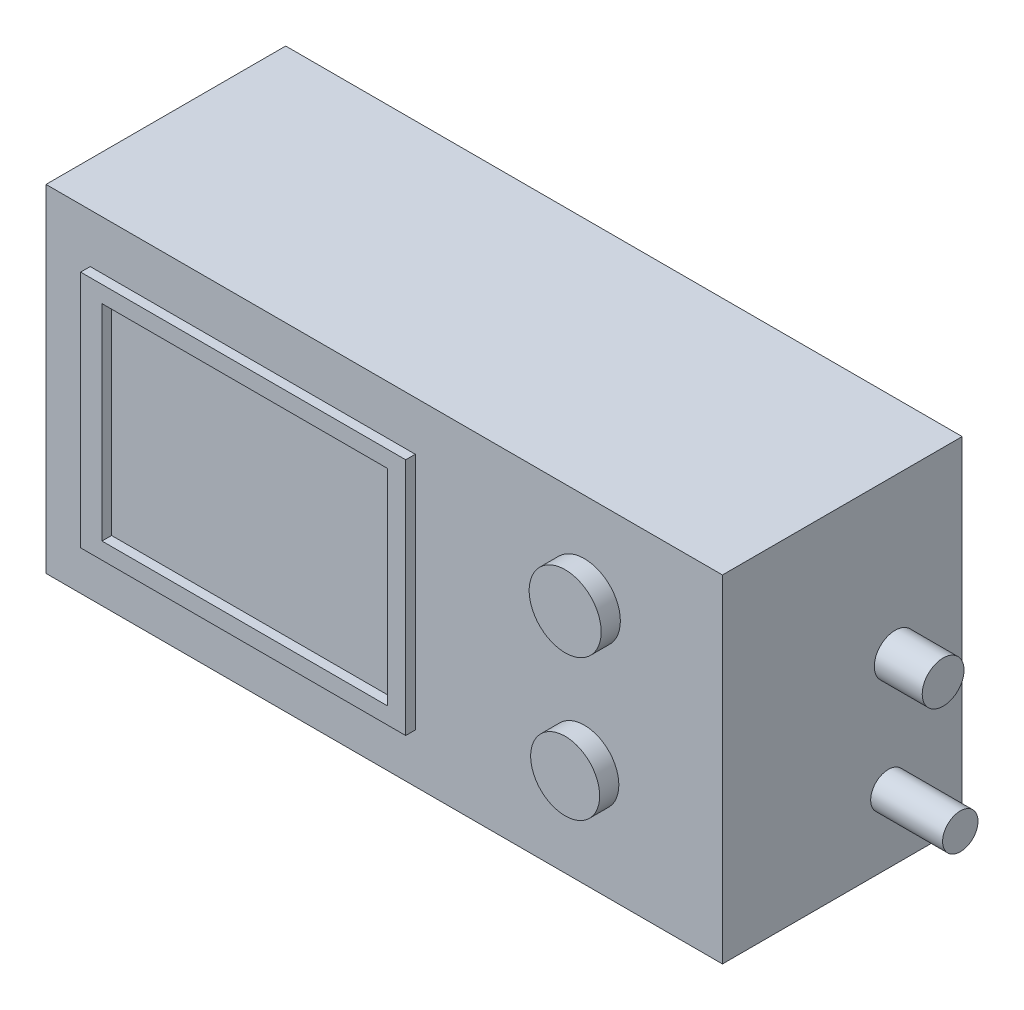
from build123d import *

# Parameters (mm, degrees)
SKETCH1_W           = 141.104496432
SKETCH1_H           = 70.279121138
BOSS_EXTRUDE1_DEPTH = 50
SKETCH2_W           = 67.805568122
SKETCH2_H           = 49.81527963
SKETCH2_W_2         = 59.592894194
SKETCH2_H_2         = 42.894286786
BOSS_EXTRUDE2_DEPTH = 2
SKETCH3_R           = 7.50966637
SKETCH3_R_2         = 7.194748193
BOSS_EXTRUDE3_DEPTH = 4
SKETCH4_R           = 4.364569168
BOSS_EXTRUDE4_DEPTH = 10
SKETCH5_R           = 3.693674176
BOSS_EXTRUDE5_DEPTH = 15


with BuildPart() as part:
    # Sketch1 → Boss-Extrude1 (new body)
    with BuildSketch(Plane.XY):
        Rectangle(SKETCH1_W, SKETCH1_H)
    extrude(amount=BOSS_EXTRUDE1_DEPTH)

    # Sketch2 → Boss-Extrude2 (add)
    with BuildSketch(Plane.XY.offset(50)):
        with Locations((-27.427958915, 0)):
            Rectangle(SKETCH2_W, SKETCH2_H)
        with Locations((-27.077866503, 0)):
            Rectangle(SKETCH2_W_2, SKETCH2_H_2, mode=Mode.SUBTRACT)
    extrude(amount=BOSS_EXTRUDE2_DEPTH)

    # Sketch3 → Boss-Extrude3 (add)
    with BuildSketch(Plane.XY.offset(50)):
        with Locations((41.743235824, 16.179657371)):
            Circle(SKETCH3_R)
        with Locations((41.743235824, -13.592283792)):
            Circle(SKETCH3_R_2)
    extrude(amount=BOSS_EXTRUDE3_DEPTH)

    # Sketch4 → Boss-Extrude4 (add)
    with BuildSketch(Plane(origin=(70.552248216, 0, 0), x_dir=(0, 0, -1), z_dir=(1, 0, 0))):
        with Locations(Location((-13.969787954, 2.76951533, 0), (0, 0, 180))):
            Circle(SKETCH4_R)
    extrude(amount=BOSS_EXTRUDE4_DEPTH)

    # Sketch5 → Boss-Extrude5 (add)
    with BuildSketch(Plane(origin=(70.552248216, 0, 0), x_dir=(0, 0, -1), z_dir=(1, 0, 0))):
        with Locations(Location((-15.390317834, -20.981701915, 0), (0, 0, 180))):
            Circle(SKETCH5_R)
    extrude(amount=BOSS_EXTRUDE5_DEPTH)


solid = part.part
